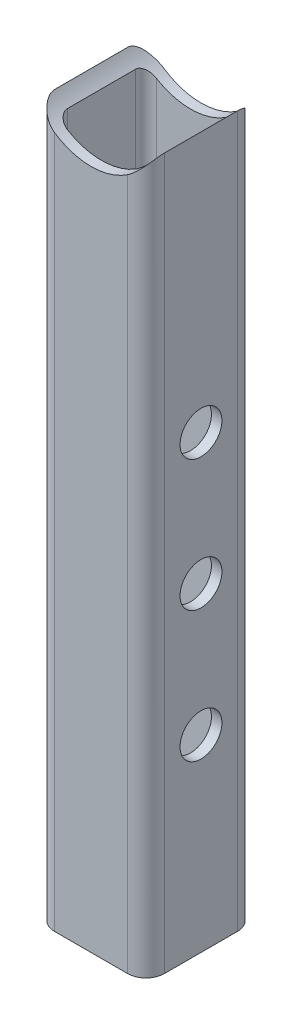
from build123d import *

# Parameters (mm, degrees)
EXTRUDE_1_DEPTH     = 140
SKETCH_2_R          = 12.5
CUT_EXTRUDE_1_DEPTH = 142.955098535
SKETCH_3_R          = 4
CUT_EXTRUDE_2_DEPTH = 138.73356885


with BuildPart() as part:
    # Эскиз1 → Бобышка-Вытянуть1 (new body)
    with BuildSketch(Plane(origin=(0, 0, 0), x_dir=(1, 0, 0), z_dir=(0, 1, 0))):
        with BuildLine():
            Line((-6.992990841, -10.5), (6.992990841, -10.5))
            ThreePointArc((6.992990841, -10.5), (9.472820799, -9.472820799), (10.5, -6.992990841))
            Line((10.5, -6.992990841), (10.5, 6.992990841))
            ThreePointArc((10.5, 6.992990841), (9.472820799, 9.472820799), (6.992990841, 10.5))
            Line((6.992990841, 10.5), (-6.992990841, 10.5))
            ThreePointArc((-6.992990841, 10.5), (-9.472820799, 9.472820799), (-10.5, 6.992990841))
            Line((-10.5, 6.992990841), (-10.5, -6.992990841))
            ThreePointArc((-10.5, -6.992990841), (-9.472820799, -9.472820799), (-6.992990841, -10.5))
        make_face()
        with BuildLine():
            Line((6.5, 8.5), (-6.5, 8.5))
            ThreePointArc((-6.5, 8.5), (-7.914213562, 7.914213562), (-8.5, 6.5))
            Line((-8.5, 6.5), (-8.5, -6.5))
            ThreePointArc((-8.5, -6.5), (-7.914213562, -7.914213562), (-6.5, -8.5))
            Line((-6.5, -8.5), (6.5, -8.5))
            ThreePointArc((6.5, -8.5), (7.914213562, -7.914213562), (8.5, -6.5))
            Line((8.5, -6.5), (8.5, 6.5))
            ThreePointArc((8.5, 6.5), (7.914213562, 7.914213562), (6.5, 8.5))
        make_face(mode=Mode.SUBTRACT)
    extrude(amount=EXTRUDE_1_DEPTH)

    # Эскиз2 → Вырез-Вытянуть1 (cut, through all)
    with BuildSketch(Plane(origin=(0, 0, -10.5), x_dir=(-1, 0, 0), z_dir=(0, 0, -1))):
        with Locations((0, 142.5)):
            Circle(SKETCH_2_R)
    extrude(amount=-CUT_EXTRUDE_1_DEPTH, mode=Mode.SUBTRACT)

    # Эскиз3 → Вырез-Вытянуть2 (cut, through all)
    with BuildSketch(Plane(origin=(10.5, 0, 0), x_dir=(0, 0, -1), z_dir=(1, 0, 0))):
        with Locations((0, 36)):
            Circle(SKETCH_3_R)
        with Locations((0, 61)):
            Circle(SKETCH_3_R)
        with Locations((0, 86)):
            Circle(SKETCH_3_R)
    extrude(amount=-CUT_EXTRUDE_2_DEPTH, mode=Mode.SUBTRACT)


solid = part.part
